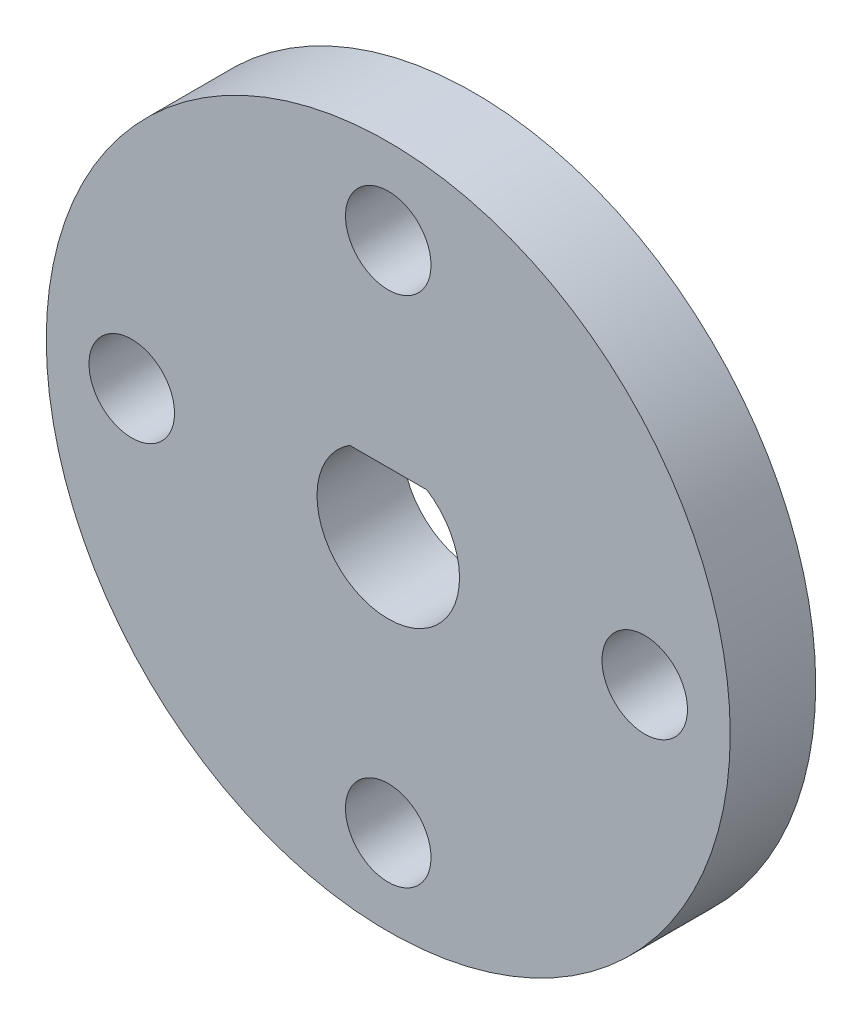
from build123d import *

# Parameters (mm, degrees)
CROQUIS1_R              = 12
CROQUIS1_R_2            = 1.5
SALIENTE_EXTRUIR1_DEPTH = 3


with BuildPart() as part:
    # Croquis1 → Saliente-Extruir1 (new body)
    with BuildSketch(Plane.XY):
        Circle(CROQUIS1_R)
        with Locations((0, 9)):
            Circle(CROQUIS1_R_2, mode=Mode.SUBTRACT)
        with Locations((9, 0)):
            Circle(CROQUIS1_R_2, mode=Mode.SUBTRACT)
        with Locations((0, -9)):
            Circle(CROQUIS1_R_2, mode=Mode.SUBTRACT)
        with Locations((-9, 0)):
            Circle(CROQUIS1_R_2, mode=Mode.SUBTRACT)
        with BuildLine():
            Line((1.356465997, 2.1), (-1.356465997, 2.1))
            ThreePointArc((-1.356465997, 2.1), (0, -2.5), (1.356465997, 2.1))
        make_face(mode=Mode.SUBTRACT)
    extrude(amount=SALIENTE_EXTRUIR1_DEPTH)


solid = part.part
